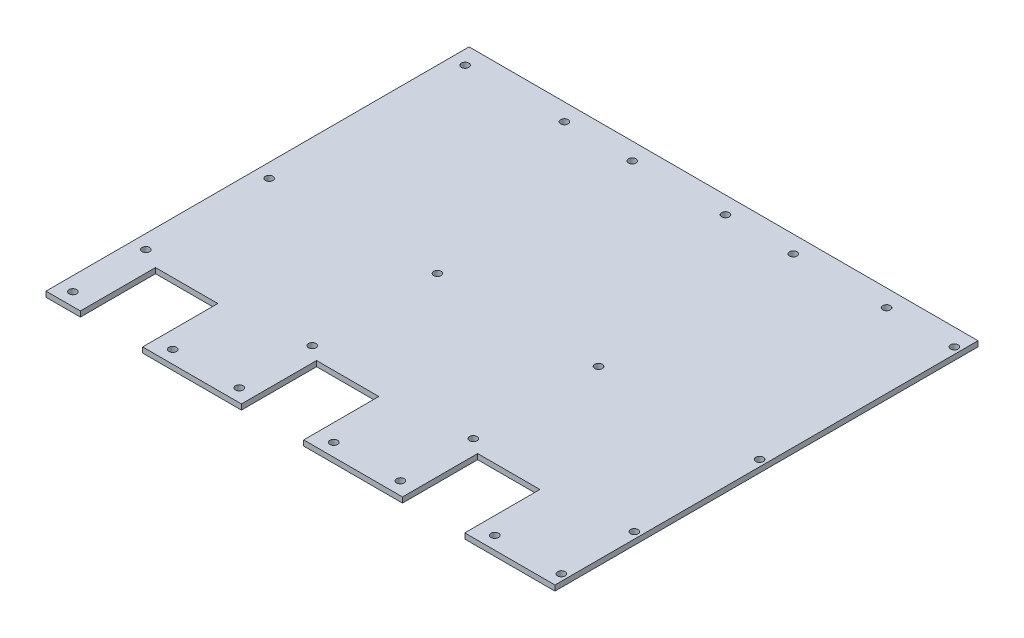
from build123d import *

# Parameters (mm, degrees)
SZKIC1_W                       = 237
SZKIC1_H                       = 197
DODANIE_WYCI_GNI_CIE1_DEPTH    = 2.5
SZKIC2_W                       = 29
SZKIC2_H                       = 35
WYTNIJ_WYCI_GNI_CIE1_DEPTH     = 3
SZYK_LINIOWY1_COUNT            = 3
SZYK_LINIOWY1_PITCH            = 75
OTWORY_USTALAJ_CE_4_0MM1_D     = 3.5
OTWORY_USTALAJ_CE_4_0MM1_DEPTH = 10


with BuildPart() as part:
    # Szkic1 → Dodanie-wyciągnięcie1 (new body)
    with BuildSketch(Plane(origin=(0, 0, 0), x_dir=(1, 0, 0), z_dir=(0, 1, 0))):
        with Locations((118.5, 98.5)):
            Rectangle(SZKIC1_W, SZKIC1_H)
    extrude(amount=DODANIE_WYCI_GNI_CIE1_DEPTH)

    # Szkic2 → Wytnij-wyciągnięcie1 (cut)
    with BuildSketch(Plane(origin=(0, 2.5, 0), x_dir=(1, 0, 0), z_dir=(0, 1, 0))):
        with Locations((30.5, 17.5)):
            Rectangle(SZKIC2_W, SZKIC2_H)
    wytnij_wyci_gni_cie1 = extrude(amount=-WYTNIJ_WYCI_GNI_CIE1_DEPTH, mode=Mode.SUBTRACT)

    # Szyk liniowy1: Wytnij-wyciągnięcie1 ×3
    with Locations(*[(i * SZYK_LINIOWY1_PITCH, 0, 0) for i in range(1, SZYK_LINIOWY1_COUNT)]):
        add(wytnij_wyci_gni_cie1, mode=Mode.SUBTRACT)

    # Otwory ustalające Ø4.0mm1
    with Locations(Plane(origin=(0, 2.5, 0), x_dir=(1, 0, 0), z_dir=(0, 1, 0))):
        with Locations((6.5, 6), (53, 6), (84, 6), (84, 98.280811552), (6.5, 97.43634097), (6.5, 188.669995221), (52.411150371, 189), (84, 189), (127.411150371, 189), (128, 6), (159, 6), (203, 6), (234, 6), (159, 98.280811552), (234, 98.280811552), (234, 189), (202.411150371, 189), (159, 189), (6.5, 40), (84, 40), (159, 40), (234, 40)):
            Hole(OTWORY_USTALAJ_CE_4_0MM1_D / 2, depth=OTWORY_USTALAJ_CE_4_0MM1_DEPTH)


solid = part.part
